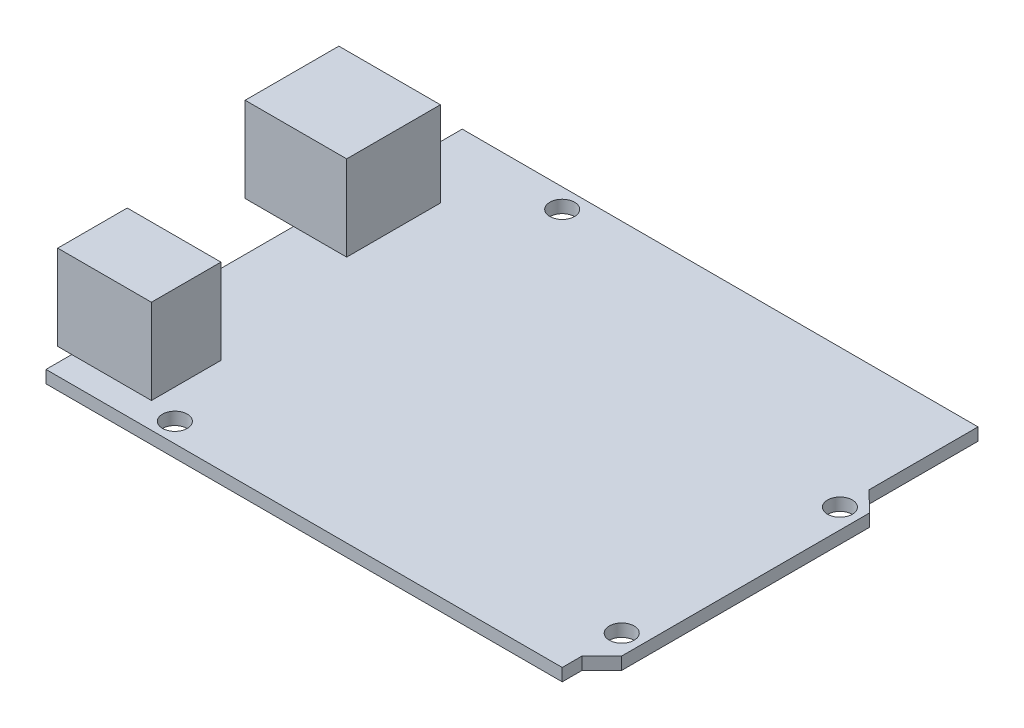
from build123d import *

# Parameters (mm, degrees)
SKETCH1_R           = 1.5875
BOSS_EXTRUDE1_DEPTH = 1.6
SKETCH2_W           = 12
SKETCH2_H           = 8.9
SKETCH2_W_2         = 13
SKETCH2_H_2         = 12
BOSS_EXTRUDE2_DEPTH = 10.9


with BuildPart() as part:
    # Sketch1 → Boss-Extrude1 (new body)
    with BuildSketch(Plane(origin=(0, 0, 0), x_dir=(1, 0, 0), z_dir=(0, 1, 0))):
        Polygon((-34.3, -26.65), (-34.3, 26.65), (31.74, 26.65), (31.74, 12.68), (34.34, 10.18), (34.34, -21.57), (31.8, -24.11), (31.8, -26.65), align=None)
        with Locations(Location((-19, 24.15, 0), (0, 0, 270))):
            Circle(SKETCH1_R, mode=Mode.SUBTRACT)
        with Locations(Location((-20.3, -24.15, 0), (0, 0, 270))):
            Circle(SKETCH1_R, mode=Mode.SUBTRACT)
        with Locations(Location((31.8, 8.91, 0), (0, 0, 270))):
            Circle(SKETCH1_R, mode=Mode.SUBTRACT)
        with Locations(Location((31.8, -19.03, 0), (0, 0, 270))):
            Circle(SKETCH1_R, mode=Mode.SUBTRACT)
    extrude(amount=BOSS_EXTRUDE1_DEPTH)

    # Sketch2 → Boss-Extrude2 (add)
    with BuildSketch(Plane(origin=(0, 1.6, 0), x_dir=(1, 0, 0), z_dir=(0, 1, 0))):
        with Locations((-30.1, -18.9)):
            Rectangle(SKETCH2_W, SKETCH2_H)
        with Locations((-34, 11.05)):
            Rectangle(SKETCH2_W_2, SKETCH2_H_2)
    extrude(amount=BOSS_EXTRUDE2_DEPTH)


solid = part.part
